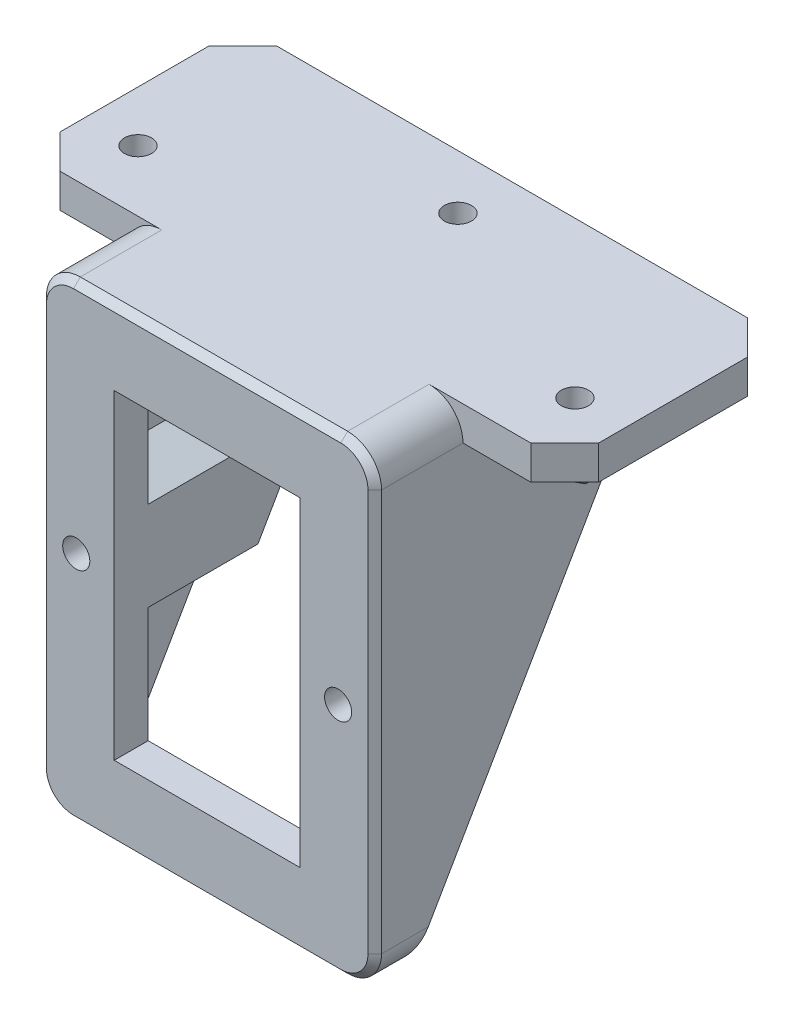
from build123d import *

# Parameters (mm, degrees)
SKETCH1_W           = 49.4
SKETCH1_H           = 69.2
SKETCH1_W_2         = 27.4
SKETCH1_H_2         = 47.2
BOSS_EXTRUDE1_DEPTH = 5
SKETCH2_R           = 2
CUT_EXTRUDE1_DEPTH  = 15
BOSS_EXTRUDE2_DEPTH = 49.4
CUT_EXTRUDE2_DEPTH  = 59.339209228
SKETCH5_W           = 27.4
SKETCH5_H           = 47.2
CUT_EXTRUDE3_DEPTH  = 93
CUT_EXTRUDE4_START  = -5
CUT_EXTRUDE4_DEPTH  = 93
SKETCH7_W           = 79.4
SKETCH7_H           = 44.952638628
BOSS_EXTRUDE3_DEPTH = 5
BOSS_EXTRUDE4_DEPTH = 3
CUT_EXTRUDE5_DEPTH  = 1
SKETCH10_R          = 2
CUT_EXTRUDE6_DEPTH  = 89.58820305
SKETCH11_W          = 15
SKETCH11_H          = 5
CUT_EXTRUDE7_DEPTH  = 13
CHAMFER1_SIZE       = 2.75
BOSS_EXTRUDE5_DEPTH = 0.5
CHAMFER2_SIZE       = 0.25
FILLET1_R           = 5
CHAMFER3_SIZE       = 1
CHAMFER4_SIZE       = 5


with BuildPart() as part:
    # Sketch1 → Boss-Extrude1 (new body)
    with BuildSketch(Plane.XY):
        Rectangle(SKETCH1_W, SKETCH1_H)
        Rectangle(SKETCH1_W_2, SKETCH1_H_2, mode=Mode.SUBTRACT)
    extrude(amount=-BOSS_EXTRUDE1_DEPTH)

    # Sketch2 → Cut-Extrude1 (cut)
    with BuildSketch(Plane.XY):
        with Locations((19.3, 0)):
            Circle(SKETCH2_R)
        with Locations(Location((-19.3, 0, 0), (0, 0, 180))):
            Circle(SKETCH2_R)
    extrude(amount=-CUT_EXTRUDE1_DEPTH, mode=Mode.SUBTRACT)

    # Sketch4 → Boss-Extrude2 (add)
    with BuildSketch(Plane(origin=(24.7, 0, 0), x_dir=(0, 0, -1), z_dir=(1, 0, 0))):
        Polygon((5, 34.6), (44.952638628, 34.6), (5, -34.6), align=None)
    extrude(amount=-BOSS_EXTRUDE2_DEPTH)

    # Sketch3 → Cut-Extrude2 (cut, through all)
    with BuildSketch(Plane(origin=(0, 0, -5), x_dir=(-1, 0, 0), z_dir=(0, 0, -1))):
        Polygon((-19.3, -4.041451884), (-15.8, -2.020725942), (-15.8, 2.020725942), (-19.3, 4.041451884), (-22.8, 2.020725942), (-22.8, -2.020725942), align=None)
        Polygon((19.3, -4.041451884), (22.8, -2.020725942), (22.8, 2.020725942), (19.3, 4.041451884), (15.8, 2.020725942), (15.8, -2.020725942), align=None)
    extrude(amount=CUT_EXTRUDE2_DEPTH, mode=Mode.SUBTRACT)

    # Sketch5 → Cut-Extrude3 (cut)
    with BuildSketch(Plane.XY.offset(-5)):
        Rectangle(SKETCH5_W, SKETCH5_H)
    extrude(amount=-CUT_EXTRUDE3_DEPTH, mode=Mode.SUBTRACT)

    # Sketch6 → Cut-Extrude4 (cut)
    with BuildSketch(Plane.XY.offset(CUT_EXTRUDE4_START)):
        Polygon((19.7, 29.6), (-19.7, 29.6), (-19.7, 10.045894684), (-10.8, 4.907477288), (-10.8, -4.907477288), (-19.7, -10.045894684), (-19.7, -34.6), (19.7, -34.6), (19.7, -10.045894684), (10.8, -4.907477288), (10.8, 4.907477288), (19.7, 10.045894684), align=None)
    extrude(amount=-CUT_EXTRUDE4_DEPTH, mode=Mode.SUBTRACT)

    # Sketch7 → Boss-Extrude3 (add)
    with BuildSketch(Plane(origin=(0, 34.6, 0), x_dir=(1, 0, 0), z_dir=(0, 1, 0))):
        with Locations((0, 22.476319314)):
            Rectangle(SKETCH7_W, SKETCH7_H)
    extrude(amount=-BOSS_EXTRUDE3_DEPTH)

    # Sketch8 → Boss-Extrude4 (add)
    # profile 1 of 3: a face of its own
    with BuildSketch(Plane.XZ.offset(-29.6)):
        Polygon((25.7, -25.75277675), (32.2, -29.505553499), (38.7, -25.75277675), (38.7, -18.24722325), (32.2, -14.494446501), (25.7, -18.24722325), align=None)
        Polygon((32.2, -17.958548116), (28.7, -19.979274058), (28.7, -24.020725942), (32.2, -26.041451884), (35.7, -24.020725942), (35.7, -19.979274058), align=None, mode=Mode.SUBTRACT)
    # profile 2 of 3: a face of its own
    with BuildSketch(Plane.XZ.offset(-29.6)):
        Polygon((-32.2, -14.494446501), (-38.7, -18.24722325), (-38.7, -25.75277675), (-32.2, -29.505553499), (-25.7, -25.75277675), (-25.7, -18.24722325), align=None)
        Polygon((-32.2, -17.958548116), (-35.7, -19.979274058), (-35.7, -24.020725942), (-32.2, -26.041451884), (-28.7, -24.020725942), (-28.7, -19.979274058), align=None, mode=Mode.SUBTRACT)
    # profile 3 of 3: a face of its own
    with BuildSketch(Plane.XZ.offset(-29.6)):
        Polygon((0, -29.447085128), (-6.5, -33.199861878), (-6.5, -40.705415378), (0, -44.458192127), (6.5, -40.705415378), (6.5, -33.199861878), align=None)
        Polygon((-3.5, -34.931912686), (-3.5, -38.97336457), (0, -40.994090512), (3.5, -38.97336457), (3.5, -34.931912686), (0, -32.911186744), align=None, mode=Mode.SUBTRACT)
    extrude(amount=BOSS_EXTRUDE4_DEPTH)

    # Sketch9 → Cut-Extrude5 (cut)
    with BuildSketch(Plane.XZ.offset(-29.6)):
        Polygon((35.7, -24.020725942), (35.7, -19.979274058), (32.2, -17.958548116), (28.7, -19.979274058), (28.7, -24.020725942), (32.2, -26.041451884), align=None)
        Polygon((3.5, -34.931912686), (0, -32.911186744), (-3.5, -34.931912686), (-3.5, -38.97336457), (0, -40.994090512), (3.5, -38.97336457), align=None)
        Polygon((-28.7, -24.020725942), (-28.7, -19.979274058), (-32.2, -17.958548116), (-35.7, -19.979274058), (-35.7, -24.020725942), (-32.2, -26.041451884), align=None)
    extrude(amount=-CUT_EXTRUDE5_DEPTH, mode=Mode.SUBTRACT)

    # Sketch10 → Cut-Extrude6 (cut, through all)
    with BuildSketch(Plane.XZ.offset(-30.6)):
        with Locations(Location((32.2, -22, 0), (0, 0, 270))):
            Circle(SKETCH10_R)
        with Locations(Location((0, -36.952638628, 0), (0, 0, 270))):
            Circle(SKETCH10_R)
        with Locations(Location((-32.2, -22, 0), (0, 0, 270))):
            Circle(SKETCH10_R)
    extrude(amount=-CUT_EXTRUDE6_DEPTH, mode=Mode.SUBTRACT)

    # Sketch11 → Cut-Extrude7 (cut)
    with BuildSketch(Plane.XY):
        with Locations((32.2, 32.1)):
            Rectangle(SKETCH11_W, SKETCH11_H)
        with Locations((-32.2, 32.1)):
            Rectangle(SKETCH11_W, SKETCH11_H)
    extrude(amount=-CUT_EXTRUDE7_DEPTH, mode=Mode.SUBTRACT)

    # Chamfer1
    chamfer1_edges = [part.edges().sort_by_distance(p)[0] for p in [
        (25.7, 26.6, -22),
        (28.95, 26.6, -27.629165125),
        (35.45, 26.6, -27.629165125),
        (38.7, 26.6, -22),
        (35.45, 26.6, -16.370834875),
        (28.95, 26.6, -16.370834875),
        (-28.95, 26.6, -16.370834875),
        (-35.45, 26.6, -16.370834875),
        (-38.7, 26.6, -22),
        (-35.45, 26.6, -27.629165125),
        (-28.95, 26.6, -27.629165125),
        (-25.7, 26.6, -22),
        (3.25, 26.6, -31.323473503),
        (-3.25, 26.6, -31.323473503),
        (-6.5, 26.6, -36.952638628),
        (-3.25, 26.6, -42.581803753),
        (3.25, 26.6, -42.581803753),
        (6.5, 26.6, -36.952638628),
    ]]
    chamfer(chamfer1_edges, length=CHAMFER1_SIZE)

    # Sketch12 → Boss-Extrude5 (add)
    # profile 1 of 3: a face of its own
    with BuildSketch(Plane.XZ.offset(-26.6)):
        Polygon((32.2, -26.041451884), (35.7, -24.020725942), (35.7, -19.979274058), (32.2, -17.958548116), (28.7, -19.979274058), (28.7, -24.020725942), align=None)
        Polygon((35.45, -20.123611625), (32.2, -18.24722325), (28.95, -20.123611625), (28.95, -23.876388375), (32.2, -25.75277675), (35.45, -23.876388375), align=None, mode=Mode.SUBTRACT)
    # profile 2 of 3: a face of its own
    with BuildSketch(Plane.XZ.offset(-26.6)):
        Polygon((3.5, -38.97336457), (3.5, -34.931912686), (0, -32.911186744), (-3.5, -34.931912686), (-3.5, -38.97336457), (0, -40.994090512), align=None)
        Polygon((-3.25, -38.829027003), (0, -40.705415378), (3.25, -38.829027003), (3.25, -35.076250253), (0, -33.199861878), (-3.25, -35.076250253), align=None, mode=Mode.SUBTRACT)
    # profile 3 of 3: a face of its own
    with BuildSketch(Plane.XZ.offset(-26.6)):
        Polygon((-32.2, -26.041451884), (-28.7, -24.020725942), (-28.7, -19.979274058), (-32.2, -17.958548116), (-35.7, -19.979274058), (-35.7, -24.020725942), align=None)
        Polygon((-35.45, -23.876388375), (-32.2, -25.75277675), (-28.95, -23.876388375), (-28.95, -20.123611625), (-32.2, -18.24722325), (-35.45, -20.123611625), align=None, mode=Mode.SUBTRACT)
    extrude(amount=-BOSS_EXTRUDE5_DEPTH)

    # Chamfer2
    chamfer2_edges = [part.edges().sort_by_distance(p)[0] for p in [
        (35.45, 26.6, -22),
        (33.825, 26.6, -24.814582562),
        (30.575, 26.6, -24.814582562),
        (28.95, 26.6, -22),
        (30.575, 26.6, -19.185417438),
        (33.825, 26.6, -19.185417438),
        (-3.25, 26.6, -36.952638628),
        (-1.625, 26.6, -34.138056066),
        (1.625, 26.6, -34.138056066),
        (3.25, 26.6, -36.952638628),
        (1.625, 26.6, -39.76722119),
        (-1.625, 26.6, -39.76722119),
        (-35.45, 26.6, -22),
        (-33.825, 26.6, -19.185417438),
        (-30.575, 26.6, -19.185417438),
        (-28.95, 26.6, -22),
        (-30.575, 26.6, -24.814582562),
        (-33.825, 26.6, -24.814582562),
    ]]
    chamfer(chamfer2_edges, length=CHAMFER2_SIZE)

    # Fillet1
    fillet1_edges = [part.edges().sort_by_distance(p)[0] for p in [
        (24.7, -34.6, -2.5),
        (-24.7, -34.6, -2.5),
        (-24.7, 34.6, -6.5),
        (24.7, 34.6, -6.5),
    ]]
    fillet(fillet1_edges, radius=FILLET1_R)

    # Chamfer3
    chamfer3_edges = [part.edges().sort_by_distance(p)[0] for p in [
        (0, -34.6, 0),
        (0, 34.6, 0),
        (-24.7, 0, 0),
        (24.7, 0, 0),
        (23.235533906, 33.135533906, 0),
        (-23.235533906, 33.135533906, 0),
        (-23.235533906, -33.135533906, 0),
        (23.235533906, -33.135533906, 0),
    ]]
    chamfer(chamfer3_edges, length=CHAMFER3_SIZE)

    # Chamfer4
    chamfer4_edges = [part.edges().sort_by_distance(p)[0] for p in [
        (-39.7, 32.1, -44.952638628),
        (39.7, 32.1, -44.952638628),
        (39.7, 32.1, -13),
        (-39.7, 32.1, -13),
    ]]
    chamfer(chamfer4_edges, length=CHAMFER4_SIZE)


solid = part.part
